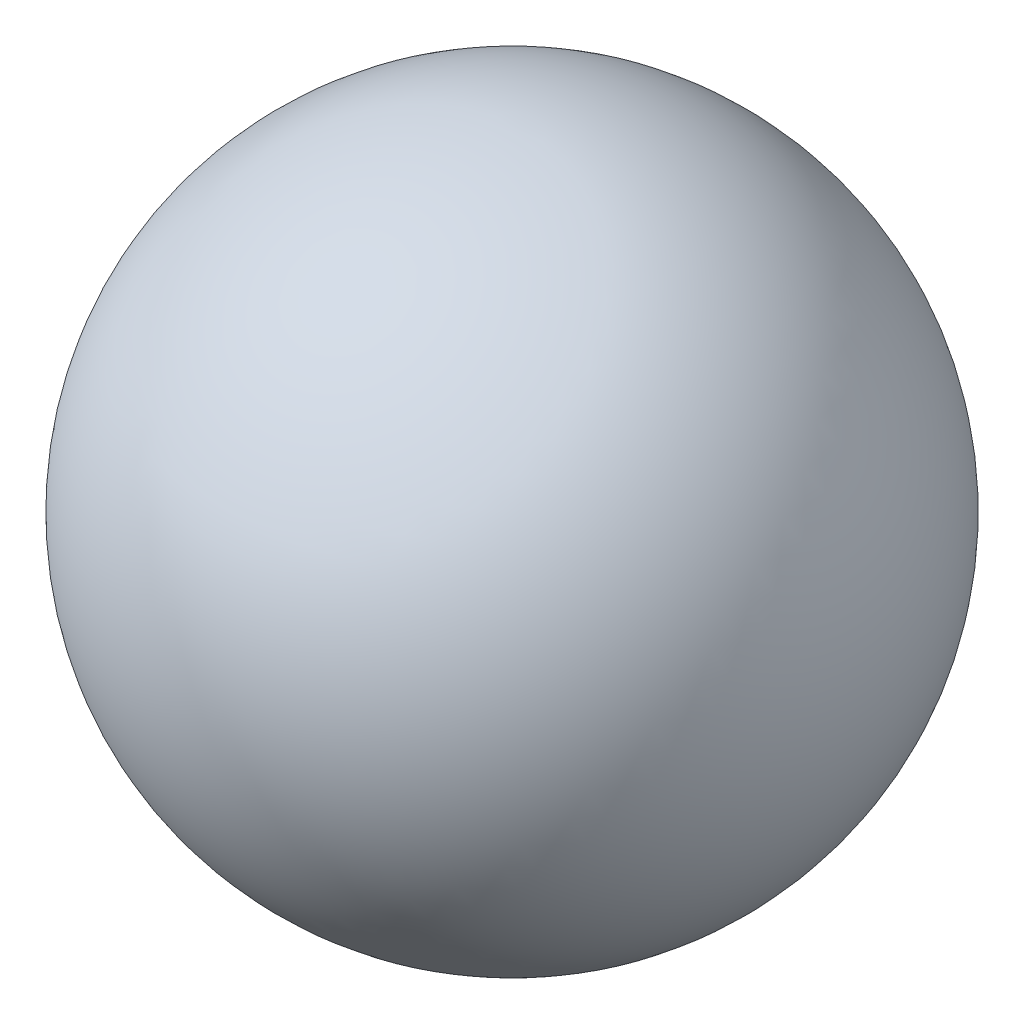
from build123d import *


with BuildPart() as part:
    # 草图1 → 旋转1 (revolve)
    with BuildSketch(Plane.XY):
        with BuildLine():
            Line((0, 7), (0, -7))
            ThreePointArc((0, -7), (-7, 0), (0, 7))
        make_face()
    revolve(axis=Axis((0, 0, 0), (0, -1, 0)))


solid = part.part
